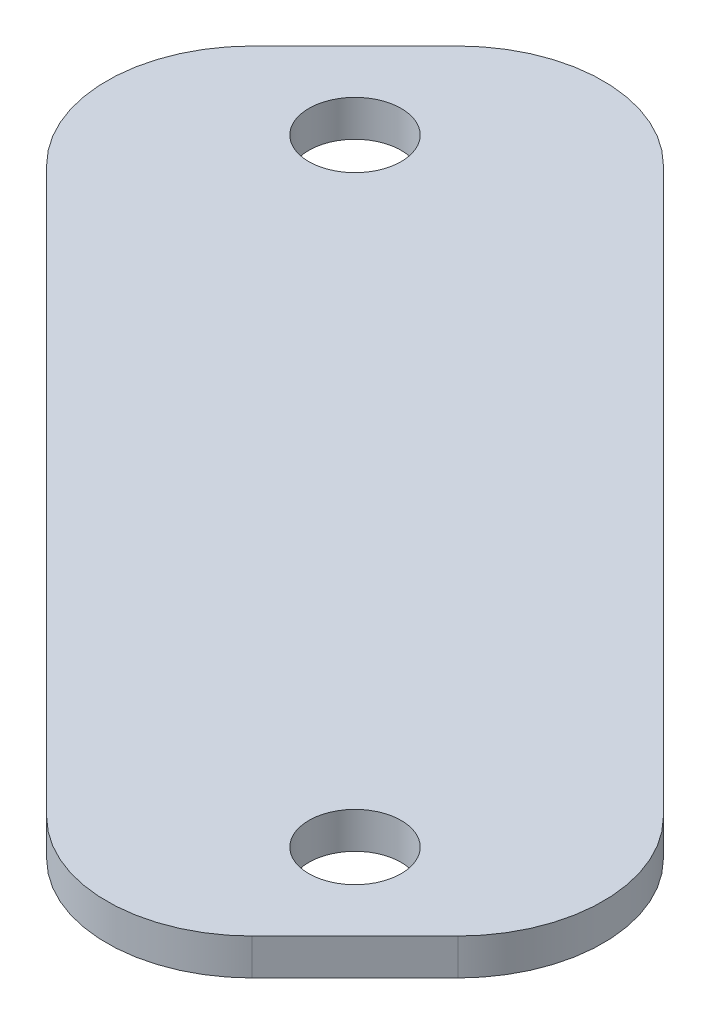
from build123d import *

# Parameters (mm, degrees)
BOSS_EXTRUDE1_DEPTH = 10
SKETCH2_R           = 12.7
CUT_EXTRUDE1_DEPTH  = 10
FILLET1_R           = 40


with BuildPart() as part:
    # Sketch1 → Boss-Extrude1 (new body)
    with BuildSketch(Plane(origin=(0, 0, 0), x_dir=(1, 0, 0), z_dir=(0, 1, 0))):
        Polygon((-63.639610307, 148.492424049), (148.492424049, -63.639610307), (63.639610307, -148.492424049), (-148.492424049, 63.639610307), align=None)
    extrude(amount=BOSS_EXTRUDE1_DEPTH)

    # Sketch2 → Cut-Extrude1 (cut)
    with BuildSketch(Plane(origin=(0, 10, 0), x_dir=(1, 0, 0), z_dir=(0, 1, 0))):
        with Locations(Location((-84.852813742, 84.852813742, 0), (0, 0, 270))):
            Circle(SKETCH2_R)
        with Locations(Location((84.852813742, -84.852813742, 0), (0, 0, 270))):
            Circle(SKETCH2_R)
    extrude(amount=-CUT_EXTRUDE1_DEPTH, mode=Mode.SUBTRACT)

    # Fillet1
    fillet1_edges = [part.edges().sort_by_distance(p)[0] for p in [
        (148.492424049, 5, 63.639610307),
        (63.639610307, 5, 148.492424049),
        (-148.492424049, 5, -63.639610307),
        (-63.639610307, 5, -148.492424049),
    ]]
    fillet(fillet1_edges, radius=FILLET1_R)


solid = part.part
